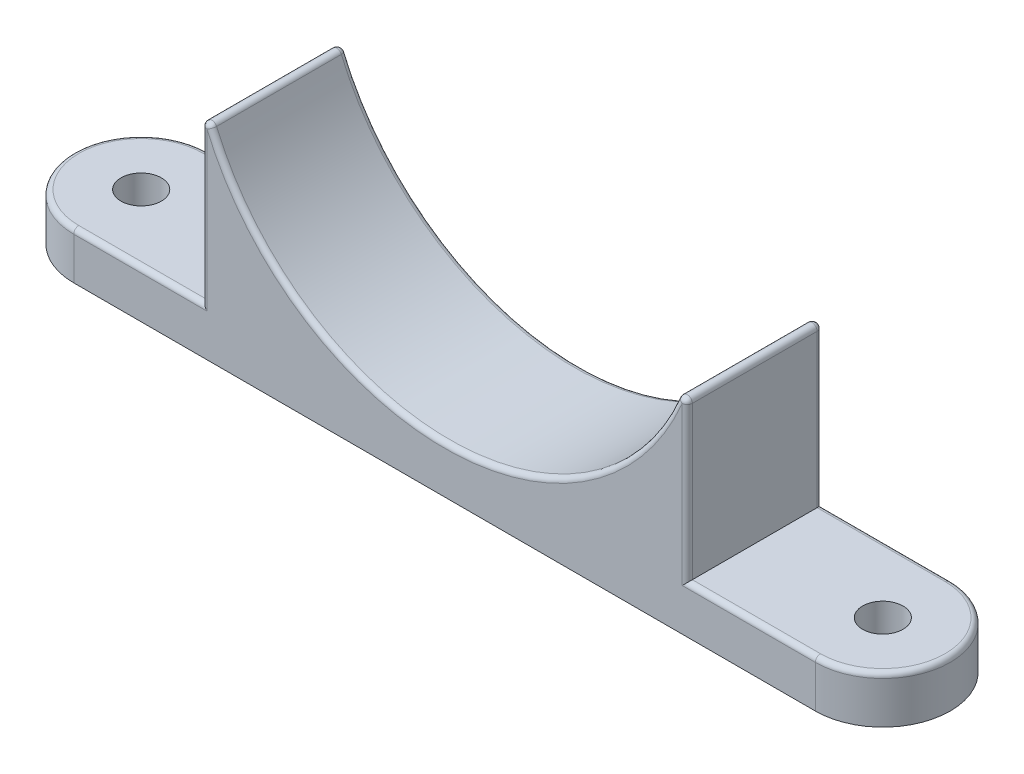
from build123d import *

# Parameters (mm, degrees)
SKETCH1_R           = 3
BOSS_EXTRUDE1_DEPTH = 7
BOSS_EXTRUDE2_DEPTH = 20
FILLET1_R           = 0.75


with BuildPart() as part:
    # Sketch1 → Boss-Extrude1 (new body)
    with BuildSketch(Plane(origin=(0, 0, 0), x_dir=(1, 0, 0), z_dir=(0, 1, 0))):
        with BuildLine():
            Line((-55, 10), (55, 10))
            ThreePointArc((55, 10), (65, 0), (55, -10))
            Line((55, -10), (-55, -10))
            ThreePointArc((-55, -10), (-65, 0), (-55, 10))
        make_face()
        with Locations(Location((-55, 0, 0), (0, 0, 270))):
            Circle(SKETCH1_R, mode=Mode.SUBTRACT)
        with Locations(Location((55, 0, 0), (0, 0, 270))):
            Circle(SKETCH1_R, mode=Mode.SUBTRACT)
    extrude(amount=BOSS_EXTRUDE1_DEPTH)

    # Sketch2 → Boss-Extrude2 (add)
    with BuildSketch(Plane.XY.offset(10)):
        with BuildLine():
            Line((-9.5e-08, 7), (36, 7))
            Line((36, 7), (36, 34))
            ThreePointArc((36, 34), (22.499999962, 14.499999972), (-9.5e-08, 7))
        make_face()
        with BuildLine():
            Line((-36, 7), (-9.5e-08, 7))
            ThreePointArc((-9.5e-08, 7), (-22.500000038, 14.500000028), (-36, 34))
            Line((-36, 34), (-36, 7))
        make_face()
    extrude(amount=-BOSS_EXTRUDE2_DEPTH)

    # Fillet1
    fillet1_edges = [part.edges().sort_by_distance(p)[0] for p in [
        (65, 7, 0),
        (45.5, 7, -10),
        (45.5, 7, 10),
        (36, 20.5, 10),
        (36, 34, 0),
        (0, 7, -10),
        (0, 7, 10),
        (36, 20.5, -10),
        (-45.5, 7, -10),
        (-36, 20.5, -10),
        (-36, 20.5, 10),
        (-36, 34, 0),
        (-65, 7, 0),
        (-45.5, 7, 10),
    ]]
    fillet(fillet1_edges, radius=FILLET1_R)


solid = part.part
